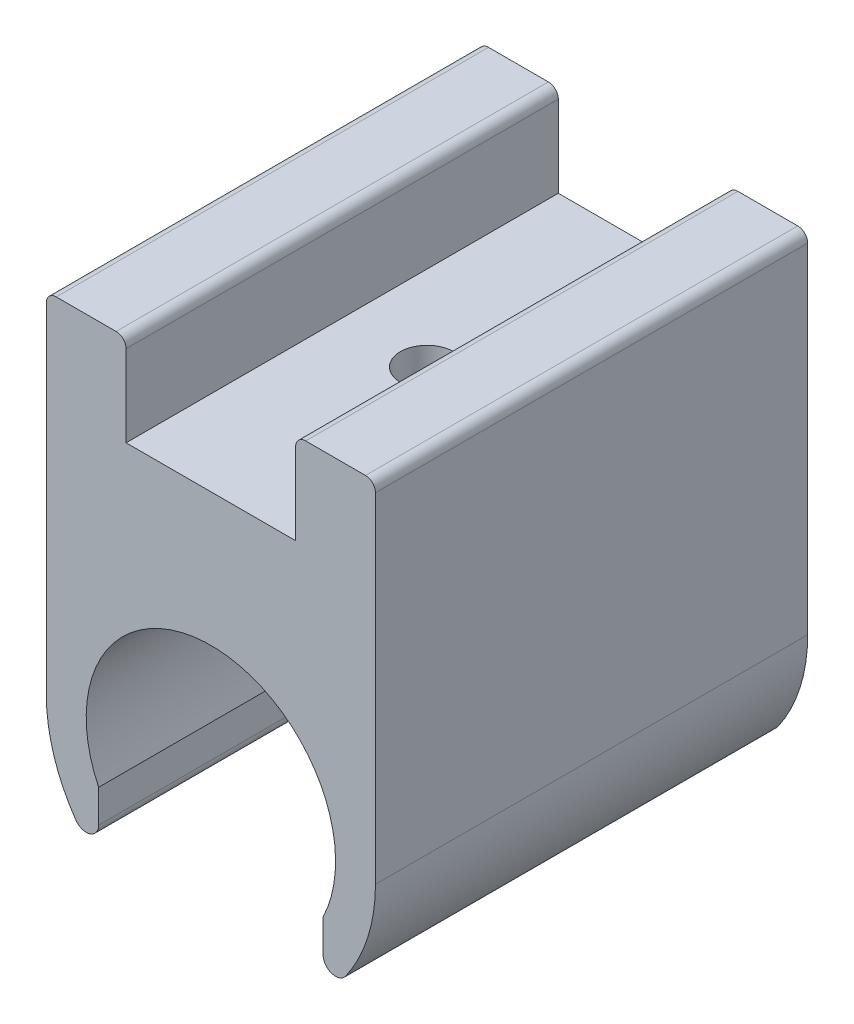
from build123d import *

# Parameters (mm, degrees)
DODANIE_WYCI_GNI_CIE1_DEPTH = 26
SZKIC2_W                    = 4.8
SZKIC2_H                    = 26
DODANIE_WYCI_GNI_CIE2_DEPTH = 5.5
ZAOKR_GLENIE1_R             = 0.75
SZKIC6_R                    = 1.6
WYTNIJ_WYCI_GNI_CIE3_DEPTH  = 2.5
SZKIC7_W                    = 6
SZKIC7_H                    = 16
WYTNIJ_WYCI_GNI_CIE4_DEPTH  = 2.4
SZKIC8_R                    = 1.6
WYTNIJ_WYCI_GNI_CIE5_DEPTH  = 2
ZAOKR_GLENIE2_R             = 0.6


with BuildPart() as part:
    # Szkic1 → Dodanie-wyciągnięcie1 (new body)
    with BuildSketch(Plane.XY):
        with BuildLine():
            Line((-6.75, -3.269174208), (-6.75, -7.242064623))
            ThreePointArc((-6.75, -7.242064623), (-9.078408451, -3.948733974), (-9.9, 0))
            Line((-9.9, 0), (-9.9, 15.5))
            Line((-9.9, 15.5), (9.9, 15.5))
            Line((9.9, 15.5), (9.9, 0))
            ThreePointArc((9.9, 0), (9.078408451, -3.948733974), (6.75, -7.242064623))
            Line((6.75, -7.242064623), (6.75, -3.269174208))
            ThreePointArc((6.75, -3.269174208), (0, 7.5), (-6.75, -3.269174208))
        make_face()
    extrude(amount=DODANIE_WYCI_GNI_CIE1_DEPTH)

    # Szkic2 → Dodanie-wyciągnięcie2 (add)
    with BuildSketch(Plane(origin=(0, 15.5, 0), x_dir=(1, 0, 0), z_dir=(0, 1, 0))):
        with Locations((-7.5, -13)):
            Rectangle(SZKIC2_W, SZKIC2_H)
        with Locations((7.5, -13)):
            Rectangle(SZKIC2_W, SZKIC2_H)
    extrude(amount=DODANIE_WYCI_GNI_CIE2_DEPTH)

    # Zaokrąglenie1
    zaokr_glenie1_edges = [part.edges().sort_by_distance(p)[0] for p in [
        (-6.75, -7.242064623, 13),
        (6.75, -7.242064623, 13),
    ]]
    fillet(zaokr_glenie1_edges, radius=ZAOKR_GLENIE1_R)

    # Szkic6 → Wytnij-wyciągnięcie3 (cut)
    with BuildSketch(Plane(origin=(0, 15.5, 0), x_dir=(1, 0, 0), z_dir=(0, 1, 0))):
        with Locations(Location((0, -13, 0), (0, 0, 180))):
            Circle(SZKIC6_R)
    extrude(amount=-WYTNIJ_WYCI_GNI_CIE3_DEPTH, mode=Mode.SUBTRACT)

    # Szkic7 → Wytnij-wyciągnięcie4 (cut)
    with BuildSketch(Plane(origin=(0, 13, 0), x_dir=(1, 0, 0), z_dir=(0, 1, 0))):
        with Locations((0, -8)):
            Rectangle(SZKIC7_W, SZKIC7_H)
    extrude(amount=-WYTNIJ_WYCI_GNI_CIE4_DEPTH, mode=Mode.SUBTRACT)

    # Szkic8 → Wytnij-wyciągnięcie5 (cut)
    with BuildSketch(Plane(origin=(0, 10.6, 0), x_dir=(1, 0, 0), z_dir=(0, 1, 0))):
        with Locations(Location((0, -13, 0), (0, 0, 180))):
            Circle(SZKIC8_R)
    extrude(amount=-WYTNIJ_WYCI_GNI_CIE5_DEPTH, mode=Mode.SUBTRACT)

    # Zaokrąglenie2
    zaokr_glenie2_edges = [part.edges().sort_by_distance(p)[0] for p in [
        (-5.1, 21, 13),
        (-9.9, 21, 13),
        (5.1, 21, 13),
        (9.9, 21, 13),
    ]]
    fillet(zaokr_glenie2_edges, radius=ZAOKR_GLENIE2_R)


solid = part.part
